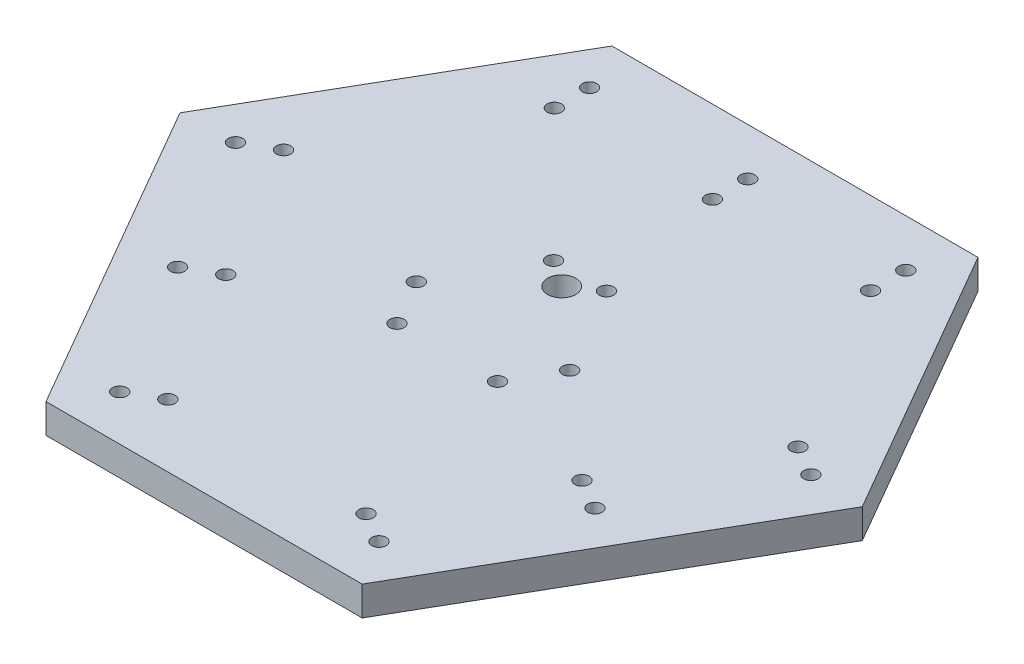
from build123d import *

# Parameters (mm, degrees)
BOSS_EXTRUDE1_DEPTH = 10
SKETCH2_OUTSIDE_W   = 431.978
SKETCH2_OUTSIDE_H   = 386.427
CUT_EXTRUDE1_DEPTH  = 10
SKETCH3_R           = 4.800665827
CUT_EXTRUDE2_DEPTH  = 10
SKETCH4_R           = 2.45
CUT_EXTRUDE3_DEPTH  = 10
SKETCH5_R           = 2.45
CUT_EXTRUDE4_DEPTH  = 10


with BuildPart() as part:
    # Sketch1 → Boss-Extrude1 (new body)
    with BuildSketch(Plane(origin=(0, 0, 0), x_dir=(1, 0, 0), z_dir=(0, 1, 0))):
        Polygon((170, 98.149545762), (-170, 98.149545762), (0, -196.299091524), align=None)
    extrude(amount=BOSS_EXTRUDE1_DEPTH)

    # Sketch2 outside → Cut-Extrude1 (cut)
    with BuildSketch(Plane(origin=(0, 10, 0), x_dir=(1, 0, 0), z_dir=(0, 1, 0))):
        with Locations((0, -49.0745)):
            Rectangle(SKETCH2_OUTSIDE_W, SKETCH2_OUTSIDE_H)
        Polygon((178.5, -103.05702305), (0, 206.114046101), (-178.5, -103.05702305), align=None, mode=Mode.SUBTRACT)
    extrude(amount=-CUT_EXTRUDE1_DEPTH, mode=Mode.SUBTRACT)

    # Sketch3 → Cut-Extrude2 (cut)
    with BuildSketch(Plane(origin=(0, 10, 0), x_dir=(1, 0, 0), z_dir=(0, 1, 0))):
        with Locations(Location((0, 18.713723456, 0), (0, 0, 270))):
            Circle(SKETCH3_R)
    extrude(amount=-CUT_EXTRUDE2_DEPTH, mode=Mode.SUBTRACT)

    # Sketch4 → Cut-Extrude3 (cut)
    with BuildSketch(Plane(origin=(0, 10, 0), x_dir=(1, 0, 0), z_dir=(0, 1, 0))):
        with Locations(Location((0, 82.049545762, 0), (0, 0, 270))):
            Circle(SKETCH4_R)
        with Locations(Location((-53.840790268, 82.049545762, 0), (0, 0, 270))):
            Circle(SKETCH4_R)
        with Locations(Location((-53.840790268, 70.049545762, 0), (0, 0, 270))):
            Circle(SKETCH4_R)
        with Locations(Location((0, 70.049545762, 0), (0, 0, 270))):
            Circle(SKETCH4_R)
        with Locations(Location((71.056990999, -41.024772881, 0), (0, 0, 270))):
            Circle(SKETCH4_R)
        with Locations(Location((60.664686154, -35.024772881, 0), (0, 0, 270))):
            Circle(SKETCH4_R)
        with Locations(Location((-71.056990999, -41.024772881, 0), (0, 0, 270))):
            Circle(SKETCH4_R)
        with Locations(Location((-60.664686154, -35.024772881, 0), (0, 0, 270))):
            Circle(SKETCH4_R)
        with Locations(Location((-87.585081287, 11.60271925, 0), (0, 0, 270))):
            Circle(SKETCH4_R)
        with Locations(Location((-97.977386133, 5.60271925, 0), (0, 0, 270))):
            Circle(SKETCH4_R)
        with Locations(Location((53.840790268, 82.049545762, 0), (0, 0, 270))):
            Circle(SKETCH4_R)
        with Locations(Location((53.840790268, 70.049545762, 0), (0, 0, 270))):
            Circle(SKETCH4_R)
        with Locations(Location((97.977386133, 5.60271925, 0), (0, 0, 270))):
            Circle(SKETCH4_R)
        with Locations(Location((87.585081287, 11.60271925, 0), (0, 0, 270))):
            Circle(SKETCH4_R)
        with Locations(Location((44.136595865, -87.652265013, 0), (0, 0, 270))):
            Circle(SKETCH4_R)
        with Locations(Location((33.74429102, -81.652265013, 0), (0, 0, 270))):
            Circle(SKETCH4_R)
        with Locations(Location((-33.74429102, -81.652265013, 0), (0, 0, 270))):
            Circle(SKETCH4_R)
        with Locations(Location((-44.136595865, -87.652265013, 0), (0, 0, 270))):
            Circle(SKETCH4_R)
    extrude(amount=-CUT_EXTRUDE3_DEPTH, mode=Mode.SUBTRACT)

    # Sketch5 → Cut-Extrude4 (cut)
    with BuildSketch(Plane(origin=(0, 10, 0), x_dir=(1, 0, 0), z_dir=(0, 1, 0))):
        with Locations(Location((26.106940443, -4.680544247, 0), (0, 0, 270))):
            Circle(SKETCH5_R)
        with Locations(Location((17.106940443, -20.269001515, 0), (0, 0, 270))):
            Circle(SKETCH5_R)
        with Locations(Location((-17.106940443, -20.269001515, 0), (0, 0, 270))):
            Circle(SKETCH5_R)
        with Locations(Location((-26.106940443, -4.680544247, 0), (0, 0, 270))):
            Circle(SKETCH5_R)
        with Locations(Location((-9, 24.949545762, 0), (0, 0, 270))):
            Circle(SKETCH5_R)
        with Locations(Location((9, 24.949545762, 0), (0, 0, 270))):
            Circle(SKETCH5_R)
    extrude(amount=-CUT_EXTRUDE4_DEPTH, mode=Mode.SUBTRACT)


solid = part.part
